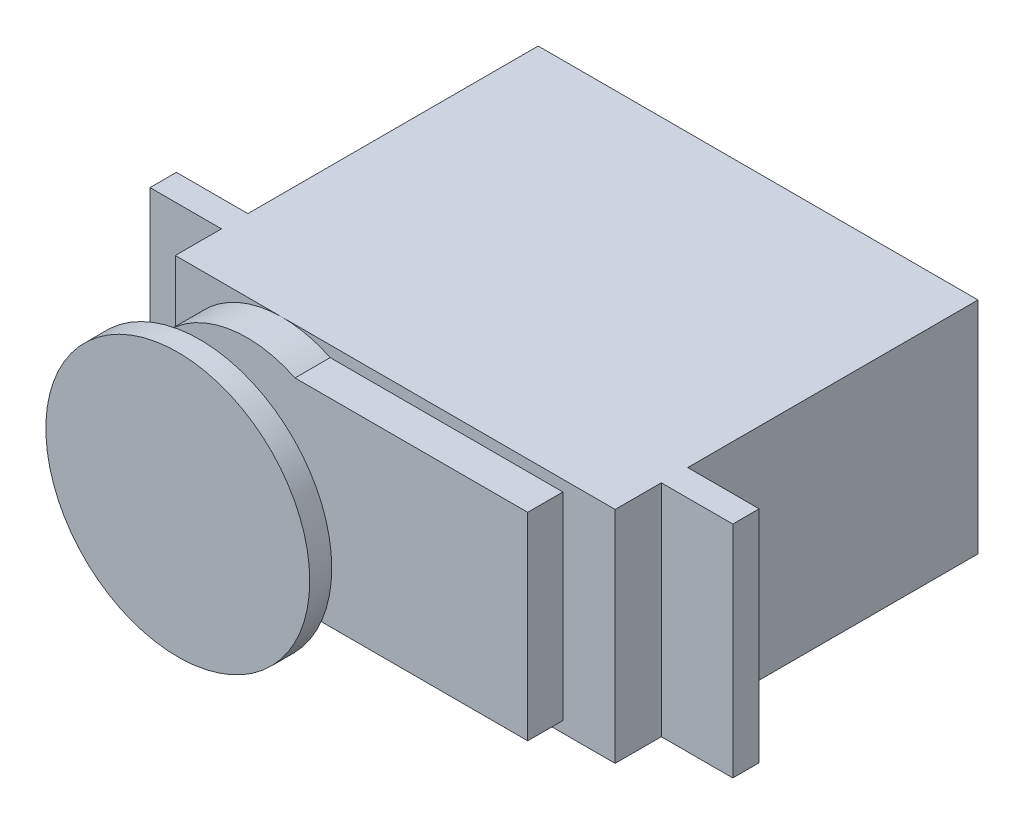
from build123d import *

# Parameters (mm, degrees)
SKETCH1_W           = 40
SKETCH1_H           = 20
BOSS_EXTRUDE1_DEPTH = 33
SKETCH3_W           = 2.4
SKETCH3_H           = 20
BOSS_EXTRUDE2_DEPTH = 6.5
SKETCH3_2_W         = 2.4
SKETCH3_2_H         = 20
BOSS_EXTRUDE3_DEPTH = 46.5
SKETCH4_R           = 5
BOSS_EXTRUDE4_DEPTH = 7.5
SKETCH5_R           = 12
BOSS_EXTRUDE5_DEPTH = 2
SKETCH6_R           = 5
BOSS_EXTRUDE6_DEPTH = 3.2


with BuildPart() as part:
    # Sketch1 → Boss-Extrude1 (new body)
    with BuildSketch(Plane.XY):
        with Locations((20, 10)):
            Rectangle(SKETCH1_W, SKETCH1_H)
    extrude(amount=BOSS_EXTRUDE1_DEPTH)

    # Sketch3 → Boss-Extrude2 (add)
    with BuildSketch(Plane(origin=(40, 0, 0), x_dir=(0, 0, -1), z_dir=(1, 0, 0))):
        with Locations((-27.6, 10)):
            Rectangle(SKETCH3_W, SKETCH3_H)
    extrude(amount=BOSS_EXTRUDE2_DEPTH)

    # Sketch3<2> → Boss-Extrude3 (add)
    with BuildSketch(Plane(origin=(40, 0, 0), x_dir=(0, 0, -1), z_dir=(1, 0, 0))):
        with Locations((-27.6, 10)):
            Rectangle(SKETCH3_2_W, SKETCH3_2_H)
    extrude(amount=-BOSS_EXTRUDE3_DEPTH)

    # Sketch4 → Boss-Extrude4 (add)
    with BuildSketch(Plane.XY.offset(33)):
        with Locations((9.726417673, 10)):
            Circle(SKETCH4_R)
    extrude(amount=BOSS_EXTRUDE4_DEPTH)

    # Sketch5 → Boss-Extrude5 (add)
    with BuildSketch(Plane.XY.offset(40.5)):
        with Locations((9.726417673, 10)):
            Circle(SKETCH5_R)
    extrude(amount=BOSS_EXTRUDE5_DEPTH)

    # Sketch6 → Boss-Extrude6 (add)
    with BuildSketch(Plane.XY.offset(33)):
        with BuildLine():
            Line((35.25, 1), (35.25, 19))
            Line((35.25, 19), (14.085316617, 19))
            ThreePointArc((14.085316617, 19), (11.962485651, 19.746794345), (9.726417673, 20))
            ThreePointArc((9.726417673, 20), (3.530895586, 17.849554514), (0, 12.323101213))
            Line((0, 12.323101213), (0, 7.676898787))
            ThreePointArc((0, 7.676898787), (3.530895586, 2.150445486), (9.726417673, 0))
            ThreePointArc((9.726417673, 0), (11.962485651, 0.253205655), (14.085316617, 1))
            Line((14.085316617, 1), (35.25, 1))
        make_face()
        with Locations((9.726417673, 10)):
            Circle(SKETCH6_R, mode=Mode.SUBTRACT)
    extrude(amount=BOSS_EXTRUDE6_DEPTH)


solid = part.part
